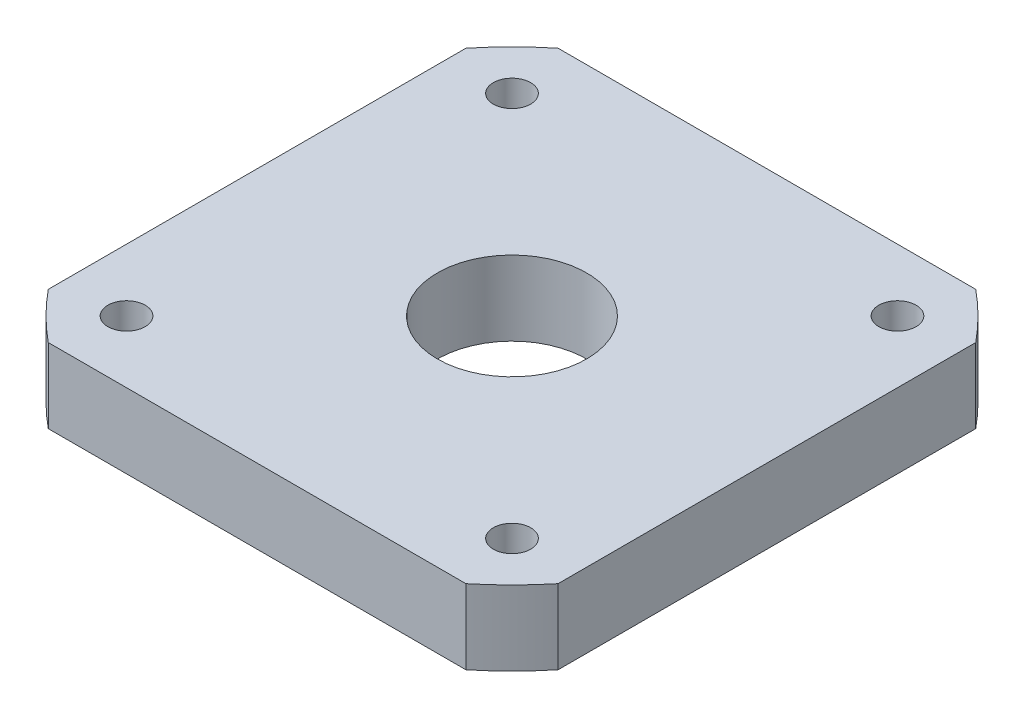
from build123d import *

# Parameters (mm, degrees)
PLATE_BASE_R   = 6
PLATE_BASE_R_2 = 1.5
HOUSING_DEPTH  = 6


with BuildPart() as part:
    # Plate Base → Housing (new body)
    with BuildSketch(Plane(origin=(0, 0, 0), x_dir=(1, 0, 0), z_dir=(0, 1, 0))):
        with BuildLine():
            Line((16.792855624, 20.5), (-16.792855624, 20.5))
            ThreePointArc((-16.792855624, 20.5), (-18.738329701, 18.738329701), (-20.5, 16.792855624))
            Line((-20.5, 16.792855624), (-20.5, -16.792855624))
            ThreePointArc((-20.5, -16.792855624), (-18.738329701, -18.738329701), (-16.792855624, -20.5))
            Line((-16.792855624, -20.5), (16.792855624, -20.5))
            ThreePointArc((16.792855624, -20.5), (18.738329701, -18.738329701), (20.5, -16.792855624))
            Line((20.5, -16.792855624), (20.5, 16.792855624))
            ThreePointArc((20.5, 16.792855624), (18.738329701, 18.738329701), (16.792855624, 20.5))
        make_face()
        with Locations(Location((0, 0, 0), (0, 0, 270))):
            Circle(PLATE_BASE_R, mode=Mode.SUBTRACT)
        with Locations(Location((15.5, 15.5, 0), (0, 0, 270))):
            Circle(PLATE_BASE_R_2, mode=Mode.SUBTRACT)
        with Locations(Location((-15.5, 15.5, 0), (0, 0, 270))):
            Circle(PLATE_BASE_R_2, mode=Mode.SUBTRACT)
        with Locations(Location((-15.5, -15.5, 0), (0, 0, 270))):
            Circle(PLATE_BASE_R_2, mode=Mode.SUBTRACT)
        with Locations(Location((15.5, -15.5, 0), (0, 0, 270))):
            Circle(PLATE_BASE_R_2, mode=Mode.SUBTRACT)
    extrude(amount=HOUSING_DEPTH)


solid = part.part
